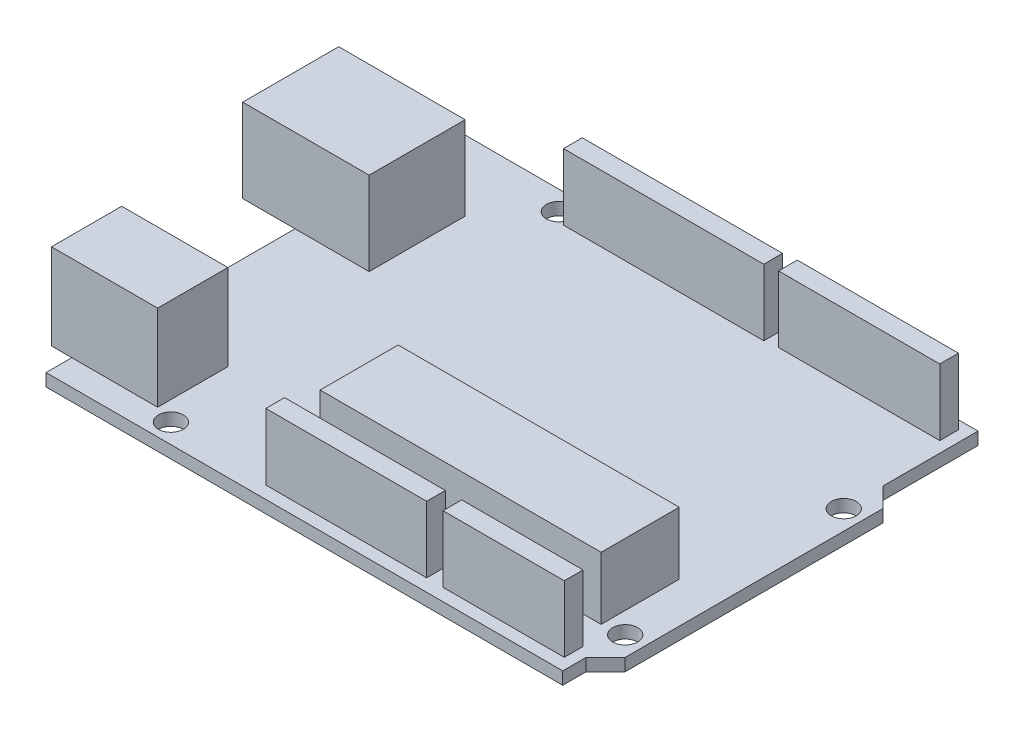
from build123d import *

# Parameters (mm, degrees)
SKETCH1_R           = 1.6
BOSS_EXTRUDE1_DEPTH = 1.6
SKETCH1_3_W         = 16.2
SKETCH1_3_H         = 12.3
BOSS_EXTRUDE2_DEPTH = 10.7
SKETCH1_4_W         = 13.6
SKETCH1_4_H         = 9
BOSS_EXTRUDE3_DEPTH = 11
SKETCH1_5_W         = 36
SKETCH1_5_H         = 10
BOSS_EXTRUDE4_DEPTH = 8
SKETCH1_6_W         = 25.66
SKETCH1_6_H         = 2.4
SKETCH1_6_W_2       = 20.65
SKETCH1_6_W_3       = 20.6
SKETCH1_6_W_4       = 15.54
BOSS_EXTRUDE5_DEPTH = 8.5


with BuildPart() as part:
    # Sketch1 → Boss-Extrude1 (new body)
    with BuildSketch(Plane(origin=(0, 0, 0), x_dir=(1, 0, 0), z_dir=(0, 1, 0))):
        Polygon((68.7, 38.5), (66.2, 41), (66.2, 53.2), (0, 53.2), (0, 0), (66.2, 0), (66.2, 3), (68.7, 5.5), align=None)
        with Locations((13.5, 2.5)):
            Circle(SKETCH1_R, mode=Mode.SUBTRACT)
        with Locations((66.2, 8)):
            Circle(SKETCH1_R, mode=Mode.SUBTRACT)
        with Locations((15, 50.7)):
            Circle(SKETCH1_R, mode=Mode.SUBTRACT)
        with Locations((66.2, 36)):
            Circle(SKETCH1_R, mode=Mode.SUBTRACT)
    extrude(amount=-BOSS_EXTRUDE1_DEPTH)

    # Sketch1<3> → Boss-Extrude2 (add)
    with BuildSketch(Plane(origin=(0, 0, 0), x_dir=(1, 0, 0), z_dir=(0, 1, 0))):
        with Locations((1.4, 38.05)):
            Rectangle(SKETCH1_3_W, SKETCH1_3_H)
    extrude(amount=BOSS_EXTRUDE2_DEPTH)

    # Sketch1<4> → Boss-Extrude3 (add)
    with BuildSketch(Plane(origin=(0, 0, 0), x_dir=(1, 0, 0), z_dir=(0, 1, 0))):
        with Locations((4.2, 7.8)):
            Rectangle(SKETCH1_4_W, SKETCH1_4_H)
    extrude(amount=BOSS_EXTRUDE3_DEPTH)

    # Sketch1<5> → Boss-Extrude4 (add)
    with BuildSketch(Plane(origin=(0, 0, 0), x_dir=(1, 0, 0), z_dir=(0, 1, 0))):
        with Locations((45.5, 12.617620005)):
            Rectangle(SKETCH1_5_W, SKETCH1_5_H)
    extrude(amount=BOSS_EXTRUDE4_DEPTH)

    # Sketch1<6> → Boss-Extrude5 (add)
    with BuildSketch(Plane(origin=(0, 0, 0), x_dir=(1, 0, 0), z_dir=(0, 1, 0))):
        with Locations((29.63, 50.7)):
            Rectangle(SKETCH1_6_W, SKETCH1_6_H)
        with Locations((54.475, 50.9)):
            Rectangle(SKETCH1_6_W_2, SKETCH1_6_H)
        with Locations((36.86, 2.8)):
            Rectangle(SKETCH1_6_W_3, SKETCH1_6_H)
        with Locations((57.03, 2.8)):
            Rectangle(SKETCH1_6_W_4, SKETCH1_6_H)
    extrude(amount=BOSS_EXTRUDE5_DEPTH)


solid = part.part
